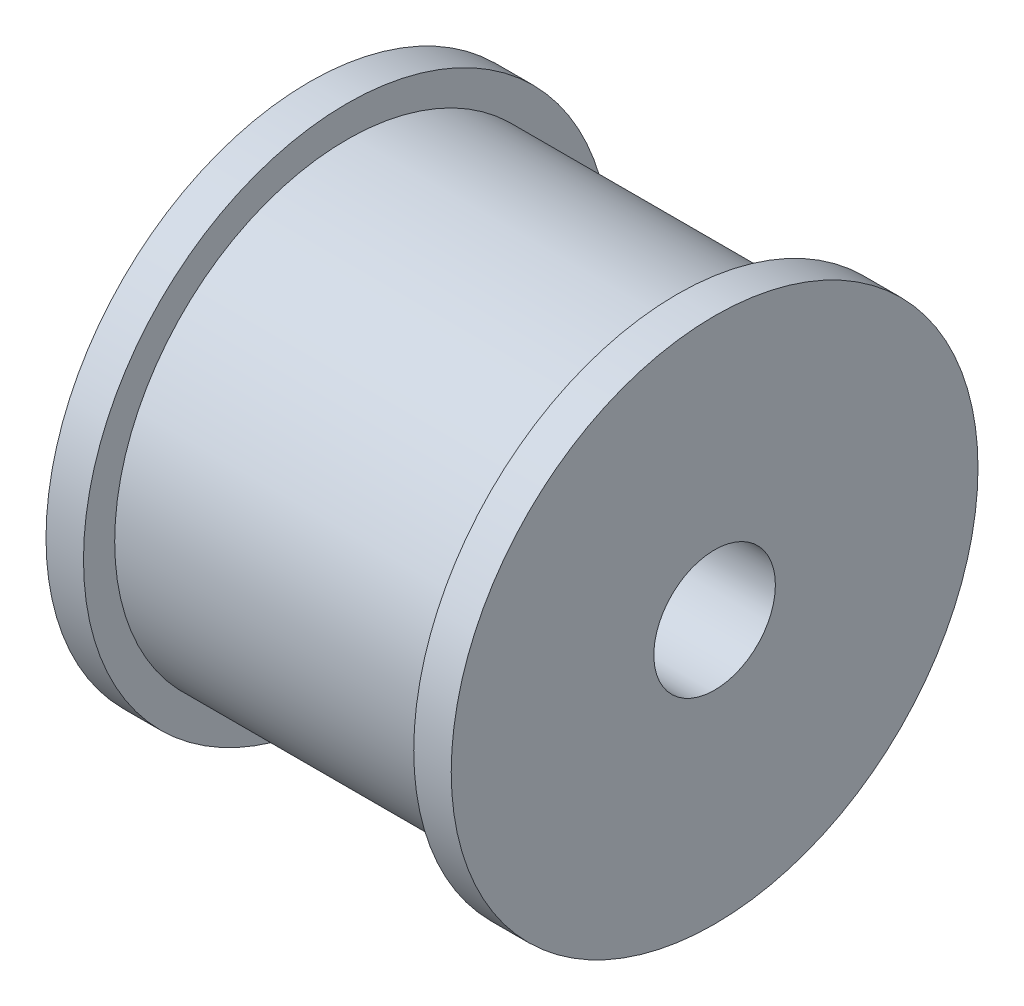
from build123d import *

# Parameters (mm, degrees)
F_6_0_6_DIAMETER_HOLE2_D     = 6
F_6_0_6_DIAMETER_HOLE2_DEPTH = 24
F_6_0_6_DIAMETER_HOLE2_TIP   = 1.802581857


with BuildPart() as part:
    # Sketch1 → Revolve1 (revolve)
    with BuildSketch(Plane(origin=(0, 0, 0), x_dir=(1, 0, 0), z_dir=(0, 1, 0))):
        Polygon((0, -11.46), (-8.15, -11.46), (-8.15, -13), (-10, -13), (-10, 0), (10, 0), (10, -13), (8.15, -13), (8.15, -11.46), align=None)
    revolve(axis=Axis((-10, 0, 0), (1, 0, 0)))

    # Ø6.0 (6) Diameter Hole2
    with Locations(Plane(origin=(10, 0, 0), x_dir=(0, 0, -1), z_dir=(1, 0, 0))):
        with Locations((0, 0)):
            Hole(F_6_0_6_DIAMETER_HOLE2_D / 2, depth=F_6_0_6_DIAMETER_HOLE2_DEPTH)
            with Locations((0, 0, -(F_6_0_6_DIAMETER_HOLE2_DEPTH + F_6_0_6_DIAMETER_HOLE2_TIP / 2))):  # 118° drill point
                Cone(0, F_6_0_6_DIAMETER_HOLE2_D / 2, F_6_0_6_DIAMETER_HOLE2_TIP, mode=Mode.SUBTRACT)


solid = part.part
